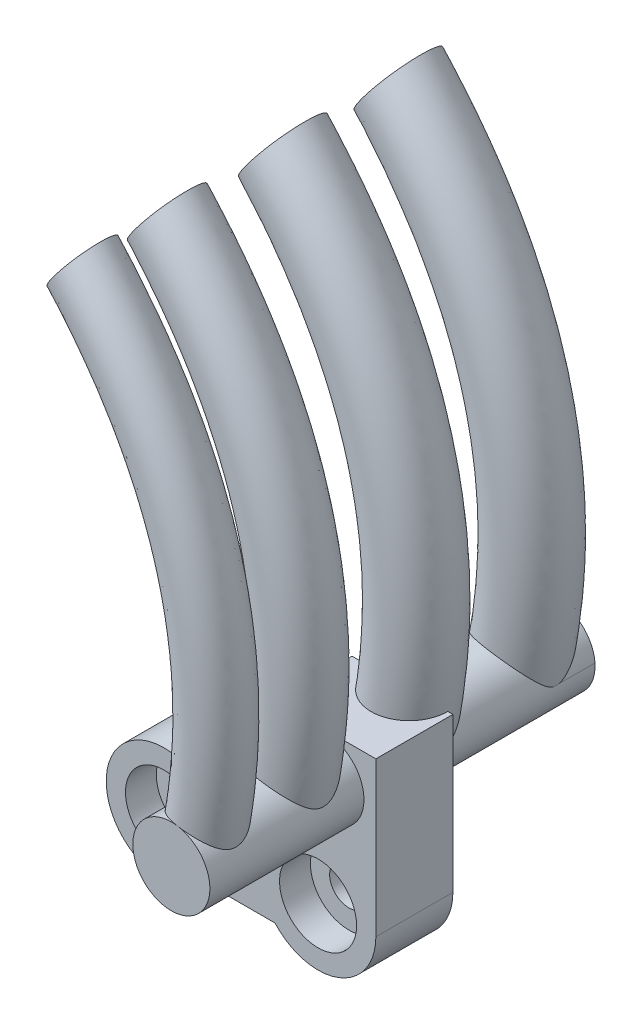
from build123d import *

# Parameters (mm, degrees)
SKETCH1_R           = 1.5
SKETCH1_R_2         = 2.5
BOSS_EXTRUDE1_DEPTH = 5
SKETCH2_R           = 5
CUT_EXTRUDE1_DEPTH  = 4
CUT_EXTRUDE3_START  = -4
SKETCH5_R           = 5
CUT_EXTRUDE3_DEPTH  = 4
BOSS_EXTRUDE2_START = -10
BOSS_EXTRUDE2_DEPTH = 10
SKETCH7_R           = 5
BOSS_EXTRUDE3_DEPTH = 25
SKETCH8_R           = 5
SKETCH8_R_2         = 4.5
SKETCH8_R_3         = 4
SKETCH10_R          = 5
CUT_EXTRUDE4_DEPTH  = 4


with BuildPart() as part:
    # Sketch1 → Boss-Extrude1 (new, symmetric)
    with BuildSketch(Plane.XY):
        with BuildLine():
            Line((4.409830056, -5), (-4.409830056, -5))
            ThreePointArc((-4.409830056, -5), (-17.5, 0), (-4.409830056, 5))
            Line((-4.409830056, 5), (4.409830056, 5))
            ThreePointArc((4.409830056, 5), (17.5, 0), (4.409830056, -5))
        make_face()
        with Locations((-10, 0)):
            Circle(SKETCH1_R, mode=Mode.SUBTRACT)
        with Locations((10, 0)):
            Circle(SKETCH1_R_2, mode=Mode.SUBTRACT)
    extrude(amount=BOSS_EXTRUDE1_DEPTH, both=True)

    # Sketch2 → Cut-Extrude1 (cut)
    with BuildSketch(Plane.XY.offset(5)):
        with Locations((10, 0)):
            Circle(SKETCH2_R)
    extrude(amount=-CUT_EXTRUDE1_DEPTH, mode=Mode.SUBTRACT)

    # Sketch5 → Cut-Extrude3 (cut)
    with BuildSketch(Plane(origin=(0, 0, -5), x_dir=(-1, 0, 0), z_dir=(0, 0, -1)).offset(CUT_EXTRUDE3_START)):
        with Locations(Location((-10, 0, 0), (0, 0, 180))):
            Circle(SKETCH5_R)
    extrude(amount=CUT_EXTRUDE3_DEPTH, mode=Mode.SUBTRACT)

    # Sketch6 → Boss-Extrude2 (add)
    with BuildSketch(Plane(origin=(0, 0, -5), x_dir=(-1, 0, 0), z_dir=(0, 0, -1)).offset(BOSS_EXTRUDE2_START)):
        with BuildLine():
            Line((-17.5, 20), (-17.5, 0))
            ThreePointArc((-17.5, 0), (-12.676165673, 7.006292692), (-4.409830056, 5))
            Line((-4.409830056, 5), (-4.409830056, 20))
            Line((-4.409830056, 20), (-17.5, 20))
        make_face()
    extrude(amount=BOSS_EXTRUDE2_DEPTH)

    # Sketch7 → Boss-Extrude3 (add, symmetric)
    with BuildSketch(Plane.XY):
        with Locations((10.954915028, 14.645828645)):
            Circle(SKETCH7_R)
    extrude(amount=BOSS_EXTRUDE3_DEPTH, both=True)

    # Sweep1: sweep along a path in Sketch9
    with BuildLine() as sweep1_path:  # in the path sketch's own coordinates; laid on its plane below (add() does not lay a ready-made edge on the line's plane)
        add(Edge.make_bspline(
            [(10.954915028, 15), (18.238943146, 47.876881482), (-4.574227678, 72.955549577)],
            knots=[0, 0, 0, 1, 1, 1], degree=2))
    # Sketch8 → Sweep1 (sweep)
    with BuildSketch(Plane(origin=(0, 15, 0), x_dir=(1, 0, 0), z_dir=(0, 1, 0))):
        with Locations((10.954915028, 20)):
            Circle(SKETCH8_R)
        with Locations((10.954915028, 5)):
            Circle(SKETCH8_R)
        with Locations((10.954915028, -10)):
            Circle(SKETCH8_R_2)
        with Locations((10.954915028, -21)):
            Circle(SKETCH8_R_3)
    sweep(path=Plane.XY * sweep1_path.line)

    # Sketch10 → Cut-Extrude4 (cut)
    with BuildSketch(Plane.XY.offset(5)):
        with Locations((-10, 0)):
            Circle(SKETCH10_R)
    extrude(amount=-CUT_EXTRUDE4_DEPTH, mode=Mode.SUBTRACT)


solid = part.part
